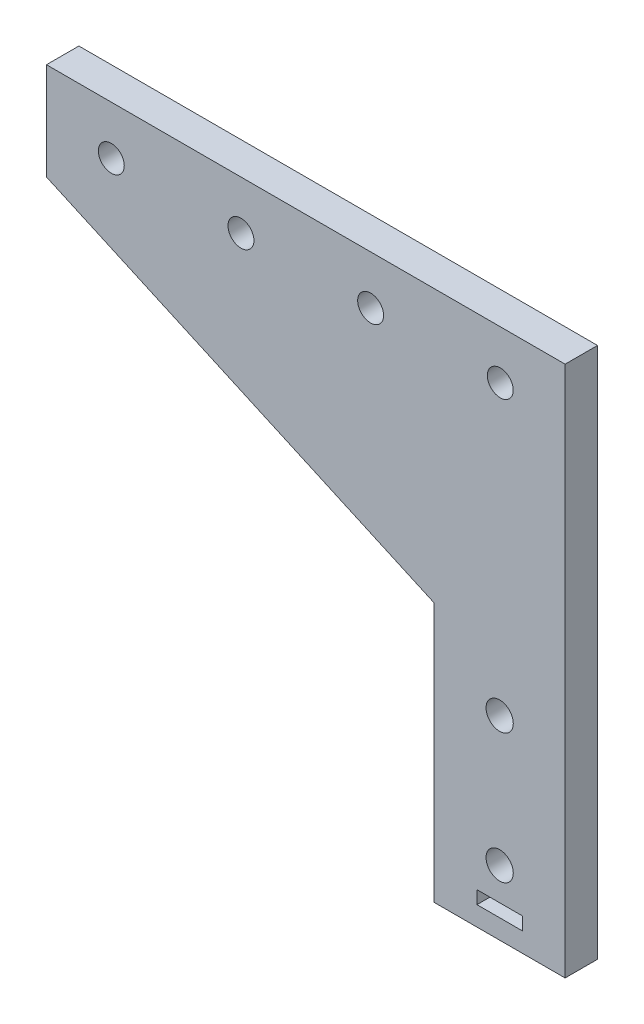
from build123d import *

# Parameters (mm, degrees)
SKETCH1_R           = 2.1
SKETCH1_R_2         = 2
SKETCH1_W           = 7
SKETCH1_H           = 2
BOSS_EXTRUDE1_DEPTH = 5


with BuildPart() as part:
    # Sketch1 → Boss-Extrude1 (new body)
    with BuildSketch(Plane.XY):
        Polygon((0, 0), (0, 82), (-80, 82), (-80, 67), (-20.191582532, 40), (-20.191582532, 0), align=None)
        with Locations((-10.095791266, 10)):
            Circle(SKETCH1_R, mode=Mode.SUBTRACT)
        with Locations((-10.095791266, 30)):
            Circle(SKETCH1_R, mode=Mode.SUBTRACT)
        with Locations((-70, 74.5)):
            Circle(SKETCH1_R_2, mode=Mode.SUBTRACT)
        with Locations((-50, 74.5)):
            Circle(SKETCH1_R_2, mode=Mode.SUBTRACT)
        with Locations((-30, 74.5)):
            Circle(SKETCH1_R_2, mode=Mode.SUBTRACT)
        with Locations((-10, 74.5)):
            Circle(SKETCH1_R_2, mode=Mode.SUBTRACT)
        with Locations((-10.095791266, 4)):
            Rectangle(SKETCH1_W, SKETCH1_H, mode=Mode.SUBTRACT)
    extrude(amount=BOSS_EXTRUDE1_DEPTH)


solid = part.part
